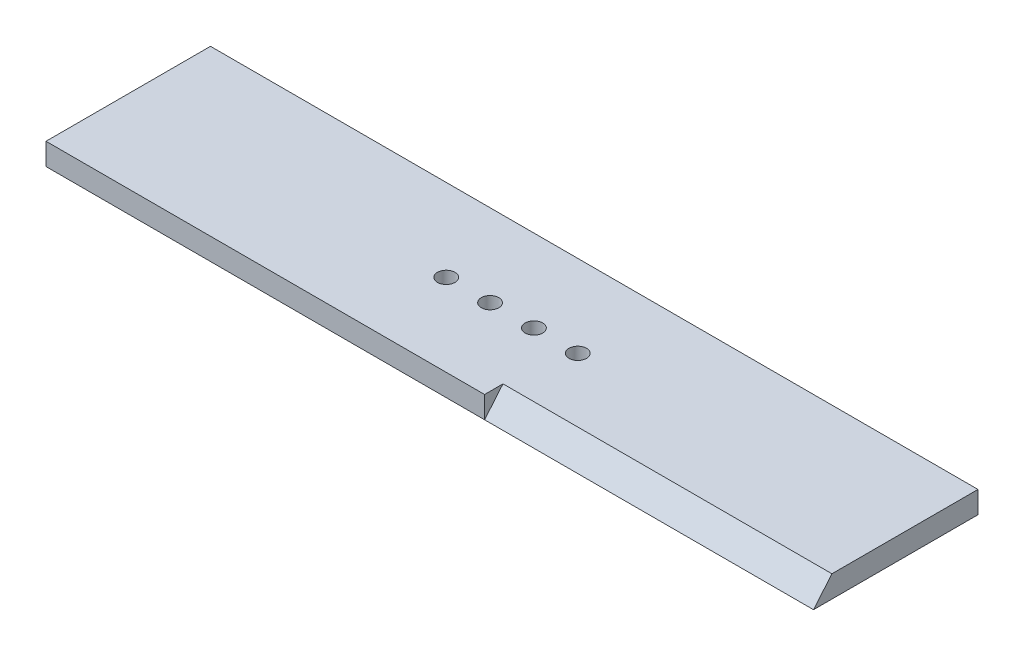
from build123d import *

# Parameters (mm, degrees)
SKETCH1_W             = 350
SKETCH1_H             = 75
BOSS_EXTRUDE2_DEPTH   = 5
F_8_0MM_DOWEL_HOLE1_D = 8
CUT_EXTRUDE3_DEPTH    = 150
CUT_EXTRUDE4_DEPTH    = 150


with BuildPart() as part:
    # Sketch1 → Boss-Extrude2 (new, symmetric)
    with BuildSketch(Plane(origin=(0, 0, 0), x_dir=(1, 0, 0), z_dir=(0, 1, 0))):
        Rectangle(SKETCH1_W, SKETCH1_H)
    extrude(amount=BOSS_EXTRUDE2_DEPTH, both=True)

    # Ø8.0mm Dowel Hole1 (through all)
    with Locations(Plane(origin=(0, 5, 0), x_dir=(1, 0, 0), z_dir=(0, 1, 0))):
        with Locations((10, 0), (30, 0), (-10, 0), (-30, 0)):
            Hole(F_8_0MM_DOWEL_HOLE1_D / 2)

    # Sketch10 → Cut-Extrude3 (cut)
    with BuildSketch(Plane(origin=(175, 0, 0), x_dir=(0, 0, -1), z_dir=(1, 0, 0))):
        Polygon((-37.5, 5), (-37.5, -5), (-29.109003688, 5), align=None)
    extrude(amount=-CUT_EXTRUDE3_DEPTH, mode=Mode.SUBTRACT)

    # Sketch11 → Cut-Extrude4 (cut)
    with BuildSketch(Plane.ZY.offset(175)):
        Polygon((-37.5, 5), (-37.5, -5), (-29.109003688, -5), align=None)
    extrude(amount=-CUT_EXTRUDE4_DEPTH, mode=Mode.SUBTRACT)


solid = part.part
